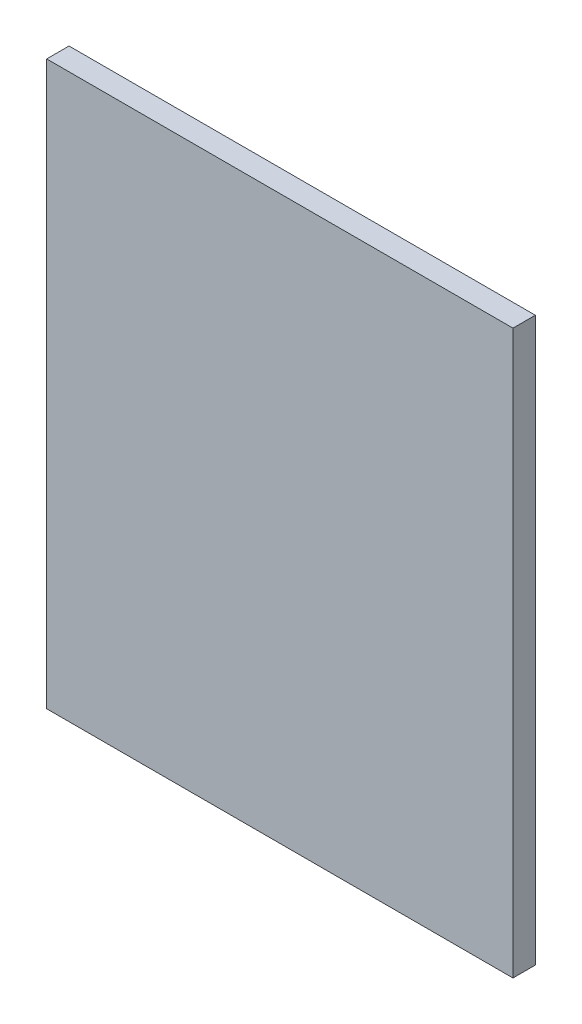
from build123d import *

# Parameters (mm, degrees)
SKETCH1_W           = 62.586720955
SKETCH1_H           = 75.540243301
BOSS_EXTRUDE1_DEPTH = 3


with BuildPart() as part:
    # Sketch1 → Boss-Extrude1 (new body)
    with BuildSketch(Plane.XY):
        with Locations((1.224872578, -15.311422077)):
            Rectangle(SKETCH1_W, SKETCH1_H)
    extrude(amount=BOSS_EXTRUDE1_DEPTH)


solid = part.part
